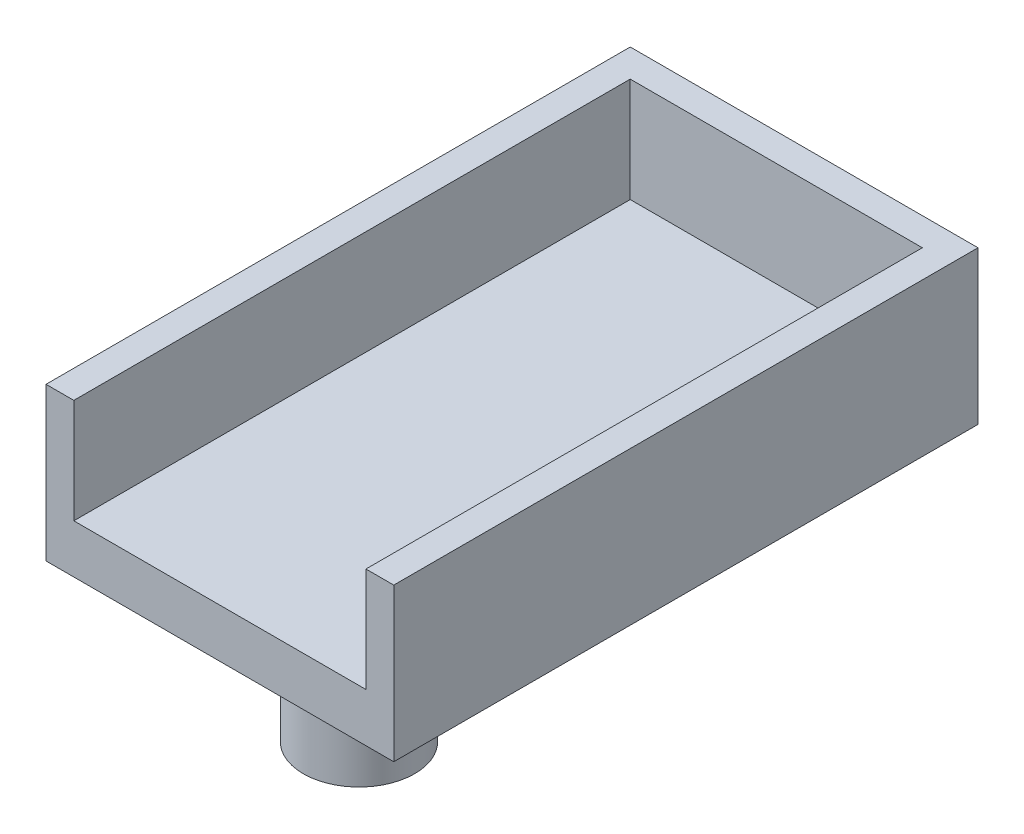
from build123d import *

# Parameters (mm, degrees)
SKETCH1_W           = 25
SKETCH1_H           = 40
BOSS_EXTRUDE1_DEPTH = 3.5
SKETCH2_W           = 2
SKETCH2_H           = 40
BOSS_EXTRUDE2_DEPTH = 7.5
SKETCH3_R           = 4
BOSS_EXTRUDE3_DEPTH = 10
SKETCH4_W           = 25
SKETCH4_H           = 11
BOSS_EXTRUDE4_DEPTH = 2


with BuildPart() as part:
    # Sketch1 → Boss-Extrude1 (new body)
    with BuildSketch(Plane(origin=(0, 0, 0), x_dir=(1, 0, 0), z_dir=(0, 1, 0))):
        with Locations((12.5, 20)):
            Rectangle(SKETCH1_W, SKETCH1_H)
    extrude(amount=BOSS_EXTRUDE1_DEPTH)

    # Sketch2 → Boss-Extrude2 (add)
    with BuildSketch(Plane(origin=(0, 3.5, 0), x_dir=(1, 0, 0), z_dir=(0, 1, 0))):
        with Locations((1, 20)):
            Rectangle(SKETCH2_W, SKETCH2_H)
        with Locations((24, 20)):
            Rectangle(SKETCH2_W, SKETCH2_H)
    extrude(amount=BOSS_EXTRUDE2_DEPTH)

    # Sketch3 → Boss-Extrude3 (add)
    with BuildSketch(Plane(origin=(0, 0, 0), x_dir=(-1, 0, 0), z_dir=(0, -1, 0))):
        with Locations(Location((-12.5, 10, 0), (0, 0, 270))):
            Circle(SKETCH3_R)
    extrude(amount=BOSS_EXTRUDE3_DEPTH)

    # Sketch4 → Boss-Extrude4 (add)
    with BuildSketch(Plane(origin=(0, 0, -40), x_dir=(-1, 0, 0), z_dir=(0, 0, -1))):
        with Locations((-12.5, 5.5)):
            Rectangle(SKETCH4_W, SKETCH4_H)
    extrude(amount=BOSS_EXTRUDE4_DEPTH)


solid = part.part
